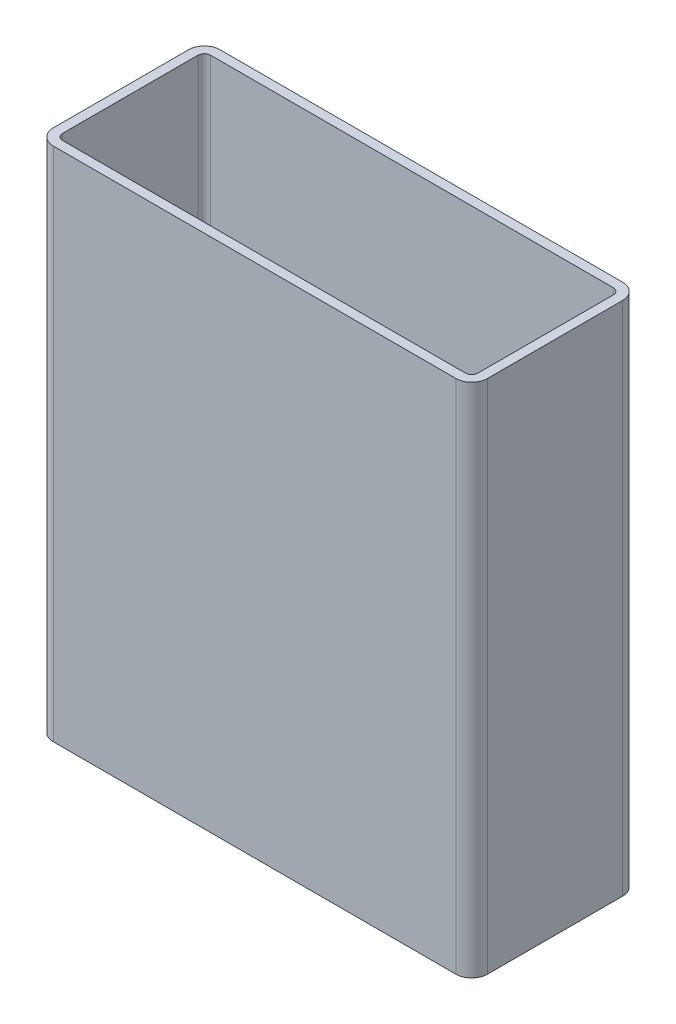
from build123d import *

# Parameters (mm, degrees)
BOSS_EXTRUDE1_DEPTH = 16.4
CUT_EXTRUDE1_DEPTH  = 14.5


with BuildPart() as part:
    # Sketch1 → Boss-Extrude1 (new body)
    with BuildSketch(Plane(origin=(0, 0, 0), x_dir=(1, 0, 0), z_dir=(0, 1, 0))):
        with BuildLine():
            Line((-6.4, -2.65), (6.4, -2.65))
            ThreePointArc((6.4, -2.65), (6.753553391, -2.503553391), (6.9, -2.15))
            Line((6.9, -2.15), (6.9, 2.15))
            ThreePointArc((6.9, 2.15), (6.753553391, 2.503553391), (6.4, 2.65))
            Line((6.4, 2.65), (-6.4, 2.65))
            ThreePointArc((-6.4, 2.65), (-6.753553391, 2.503553391), (-6.9, 2.15))
            Line((-6.9, 2.15), (-6.9, -2.15))
            ThreePointArc((-6.9, -2.15), (-6.753553391, -2.503553391), (-6.4, -2.65))
        make_face()
    extrude(amount=BOSS_EXTRUDE1_DEPTH)

    # Sketch2 → Cut-Extrude1 (cut)
    with BuildSketch(Plane(origin=(0, 16.4, 0), x_dir=(1, 0, 0), z_dir=(0, 1, 0))):
        with BuildLine():
            Line((6.4, 2.35), (-6.4, 2.35))
            ThreePointArc((-6.4, 2.35), (-6.541421356, 2.291421356), (-6.6, 2.15))
            Line((-6.6, 2.15), (-6.6, -2.15))
            ThreePointArc((-6.6, -2.15), (-6.541421356, -2.291421356), (-6.4, -2.35))
            Line((-6.4, -2.35), (6.4, -2.35))
            ThreePointArc((6.4, -2.35), (6.541421356, -2.291421356), (6.6, -2.15))
            Line((6.6, -2.15), (6.6, 2.15))
            ThreePointArc((6.6, 2.15), (6.541421356, 2.291421356), (6.4, 2.35))
        make_face()
    extrude(amount=-CUT_EXTRUDE1_DEPTH, mode=Mode.SUBTRACT)


solid = part.part
